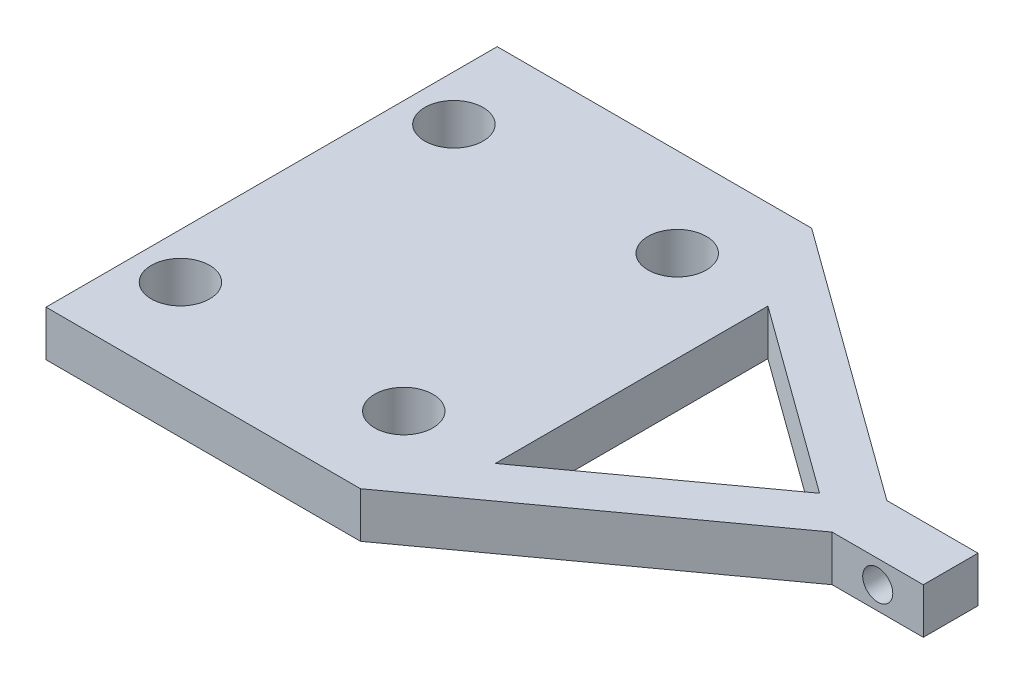
from build123d import *

# Parameters (mm, degrees)
SKETCH1_W           = 34.5
SKETCH1_H           = 49.5
BOSS_EXTRUDE1_DEPTH = 5
SKETCH2_R           = 3.2
CUT_EXTRUDE1_DEPTH  = 5
SKETCH3_W           = 6
SKETCH3_H           = 25
BOSS_EXTRUDE2_DEPTH = 5
FILLET1_R           = 10
FILLET2_R           = 5
SKETCH6_W           = 166.1846994
SKETCH6_H           = 49.5
CUT_EXTRUDE3_DEPTH  = 10
BOSS_EXTRUDE3_DEPTH = 5
SKETCH8_R           = 1.65
CUT_EXTRUDE4_DEPTH  = 10


with BuildPart() as part:
    # Sketch1 → Boss-Extrude1 (new body)
    with BuildSketch(Plane(origin=(0, 0, 0), x_dir=(1, 0, 0), z_dir=(0, 1, 0))):
        with Locations((17.25, 24.75)):
            Rectangle(SKETCH1_W, SKETCH1_H)
    extrude(amount=BOSS_EXTRUDE1_DEPTH)

    # Sketch2 → Cut-Extrude1 (cut)
    with BuildSketch(Plane(origin=(0, 5, 0), x_dir=(1, 0, 0), z_dir=(0, 1, 0))):
        with Locations(Location((5, 39.75, 0), (0, 0, 270))):
            Circle(SKETCH2_R)
        with Locations(Location((5, 9.75, 0), (0, 0, 90))):
            Circle(SKETCH2_R)
        with Locations(Location((29.5, 9.75, 0), (0, 0, 270))):
            Circle(SKETCH2_R)
        with Locations(Location((29.5, 39.75, 0), (0, 0, 90))):
            Circle(SKETCH2_R)
    extrude(amount=-CUT_EXTRUDE1_DEPTH, mode=Mode.SUBTRACT)

    # Sketch3 → Boss-Extrude2 (add)
    with BuildSketch(Plane(origin=(0, 5, 0), x_dir=(1, 0, 0), z_dir=(0, 1, 0))):
        Polygon((189.75, 42.25), (34.5, 49.5), (34.5, 41.491281612), (84.094915791, 39.175254948), (84.094915791, 10.324745052), (34.5, 8.008718388), (34.5, 0), (189.75, 7.25), align=None)
        Polygon((171.053500921, 14.385612956), (89.094915791, 10.558239416), (89.094915791, 38.941760584), (171.053500921, 35.114387044), align=None, mode=Mode.SUBTRACT)
        with Locations((181.13, 24.75)):
            Rectangle(SKETCH3_W, SKETCH3_H, mode=Mode.SUBTRACT)
    extrude(amount=-BOSS_EXTRUDE2_DEPTH)

    # Fillet1
    fillet1_edges = [part.edges().sort_by_distance(p)[0] for p in [
        (34.5, 2.5, -8.008718388),
        (84.094915791, 2.5, -10.324745052),
        (84.094915791, 2.5, -39.175254948),
        (34.5, 2.5, -41.491281612),
        (89.094915791, 2.5, -38.941760584),
        (89.094915791, 2.5, -10.558239416),
    ]]
    fillet(fillet1_edges, radius=FILLET1_R)

    # Fillet2
    fillet2_edges = [part.edges().sort_by_distance(p)[0] for p in [
        (171.053500921, 2.5, -35.114387044),
        (171.053500921, 2.5, -14.385612956),
    ]]
    fillet(fillet2_edges, radius=FILLET2_R)

    # Sketch6 → Cut-Extrude3 (cut)
    with BuildSketch(Plane(origin=(0, 5, 0), x_dir=(1, 0, 0), z_dir=(0, 1, 0))):
        with Locations((117.5923497, 24.75)):
            Rectangle(SKETCH6_W, SKETCH6_H)
    extrude(amount=-CUT_EXTRUDE3_DEPTH, mode=Mode.SUBTRACT)

    # Sketch7 → Boss-Extrude3 (add)
    with BuildSketch(Plane(origin=(0, 5, 0), x_dir=(1, 0, 0), z_dir=(0, 1, 0))):
        Polygon((64.5, 27.75), (34.5, 49.5), (34.5, 0), (64.5, 21.75), (74.5, 21.75), (74.5, 27.75), align=None)
        Polygon((60.119572878, 24.75), (39.5, 39.699190336), (39.5, 9.800809664), align=None, mode=Mode.SUBTRACT)
    extrude(amount=-BOSS_EXTRUDE3_DEPTH)

    # Sketch8 → Cut-Extrude4 (cut)
    with BuildSketch(Plane.XY.offset(-21.75)):
        with Locations((69.5, 2.5)):
            Circle(SKETCH8_R)
    extrude(amount=-CUT_EXTRUDE4_DEPTH, mode=Mode.SUBTRACT)


solid = part.part
